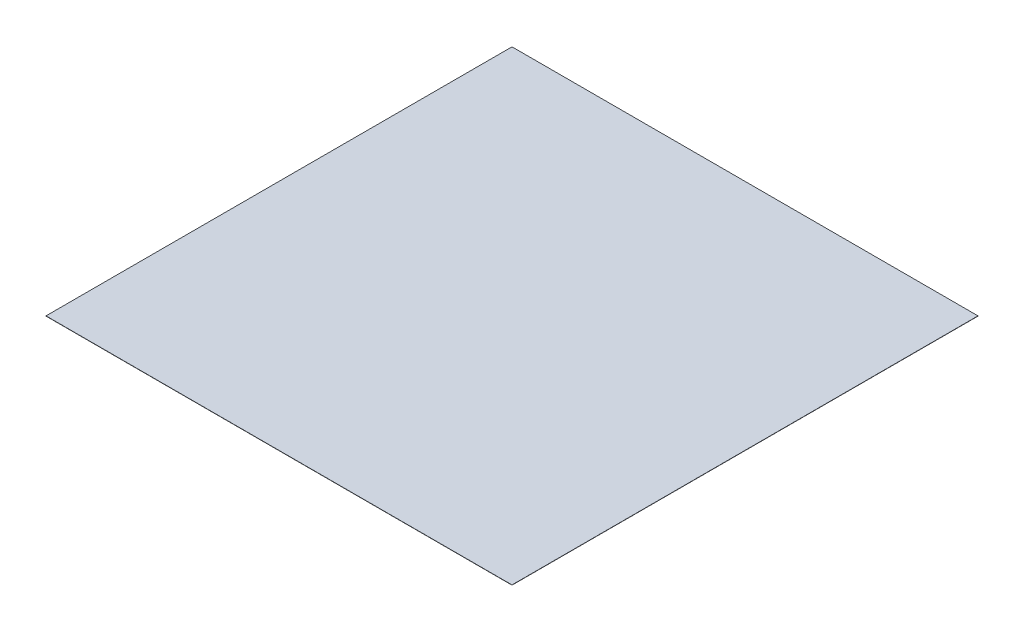
from build123d import *

# Parameters (mm, degrees)
SKETCH1_W           = 2000
SKETCH1_H           = 2000
BOSS_EXTRUDE1_DEPTH = 1


with BuildPart() as part:
    # Sketch1 → Boss-Extrude1 (new body)
    with BuildSketch(Plane(origin=(0, 0, 0), x_dir=(1, 0, 0), z_dir=(0, 1, 0))):
        Rectangle(SKETCH1_W, SKETCH1_H)
    extrude(amount=BOSS_EXTRUDE1_DEPTH)


solid = part.part
